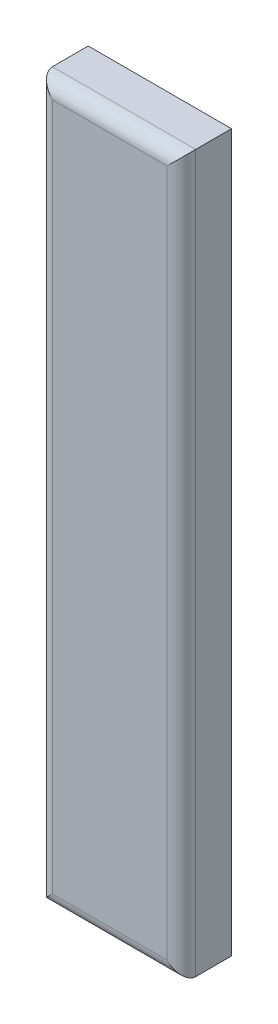
from build123d import *

# Parameters (mm, degrees)
SKETCH1_W           = 20
SKETCH1_H           = 100
BOSS_EXTRUDE1_DEPTH = 7
FILLET1_R           = 2


with BuildPart() as part:
    # Sketch1 → Boss-Extrude1 (new body)
    with BuildSketch(Plane.XY):
        Rectangle(SKETCH1_W, SKETCH1_H)
    extrude(amount=BOSS_EXTRUDE1_DEPTH)

    # Fillet1
    fillet1_edges = [part.edges().sort_by_distance(p)[0] for p in [
        (-10, 0, 7),
        (0, -50, 7),
        (10, 0, 7),
        (0, 50, 7),
    ]]
    fillet(fillet1_edges, radius=FILLET1_R)


solid = part.part
